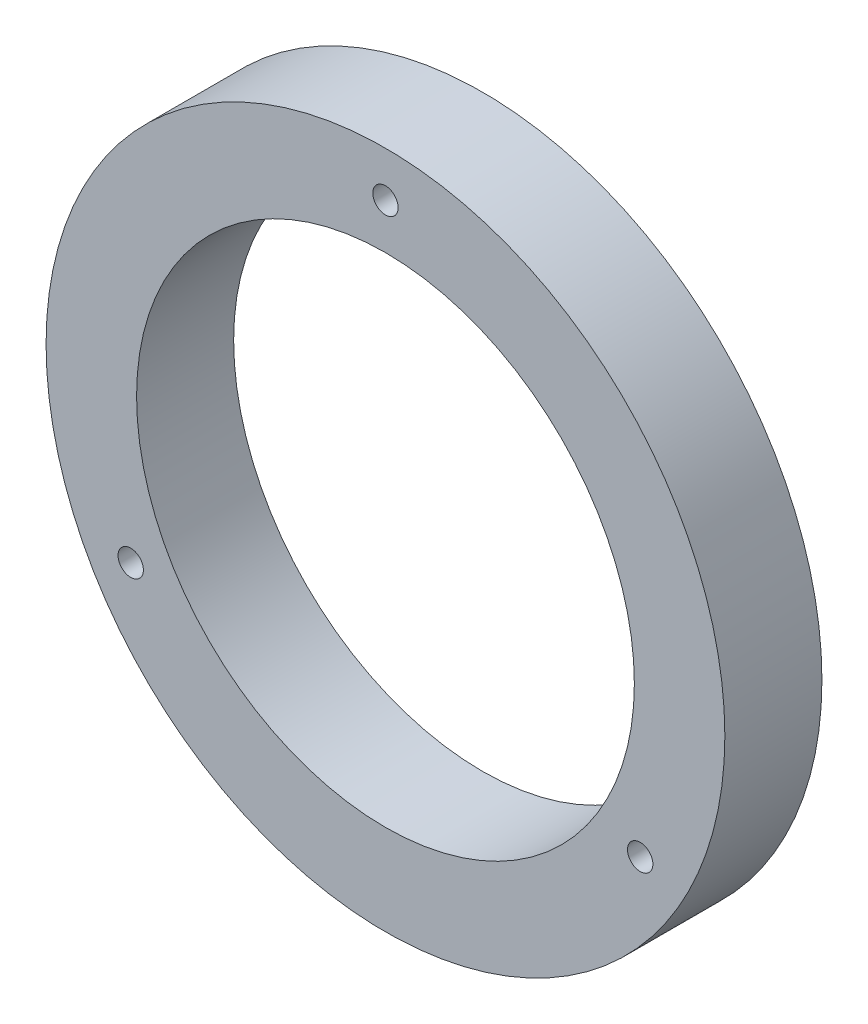
from build123d import *

# Parameters (mm, degrees)
SKETCH1_R           = 75
SKETCH1_R_2         = 55
BOSS_EXTRUDE1_DEPTH = 21.45
SKETCH3_R           = 2.8
CUT_EXTRUDE1_DEPTH  = 27.8


with BuildPart() as part:
    # Sketch1 → Boss-Extrude1 (new body)
    with BuildSketch(Plane.XY):
        Circle(SKETCH1_R)
        Circle(SKETCH1_R_2, mode=Mode.SUBTRACT)
    extrude(amount=BOSS_EXTRUDE1_DEPTH)

    # Sketch3 → Cut-Extrude1 (cut)
    with BuildSketch(Plane(origin=(0, 0, 0), x_dir=(-1, 0, 0), z_dir=(0, 0, -1))):
        with Locations((0, 65)):
            Circle(SKETCH3_R)
        with Locations((56.291651246, -32.5)):
            Circle(SKETCH3_R)
        with Locations((-56.291651246, -32.5)):
            Circle(SKETCH3_R)
    extrude(amount=-CUT_EXTRUDE1_DEPTH, mode=Mode.SUBTRACT)


solid = part.part
